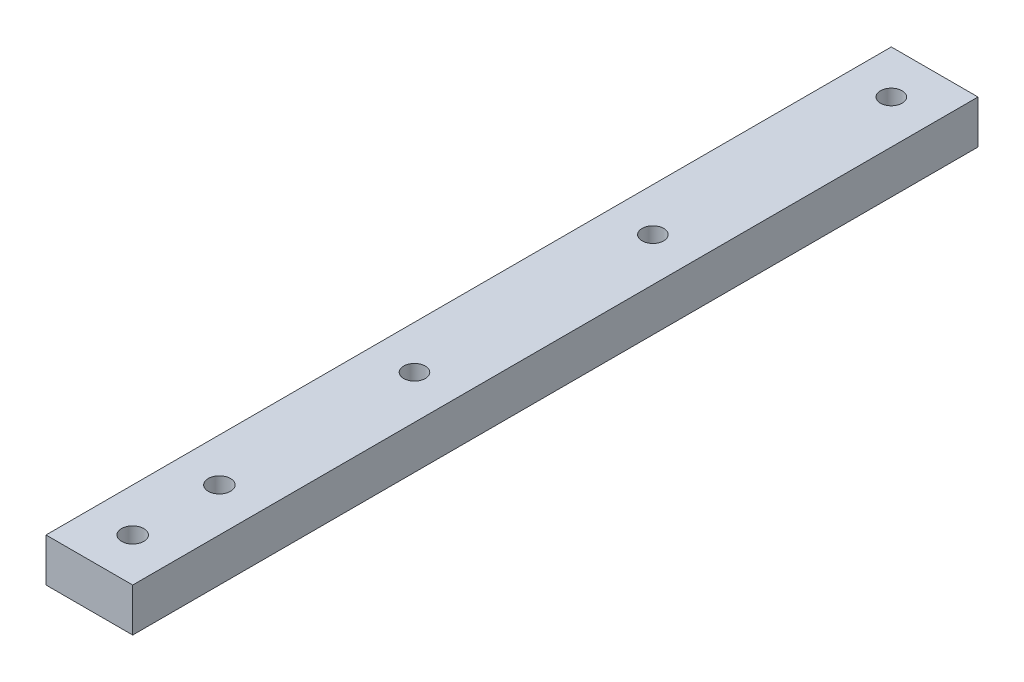
from build123d import *

# Parameters (mm, degrees)
SKETCH1_W                   = 25.4
SKETCH1_H                   = 12.7
BOSS_EXTRUDE1_DEPTH         = 247.65
F_1_4_CLEARANCE_HOLE1_D     = 6.5278
F_1_4_0_25_DIAMETER_HOLE1_D = 6.35


with BuildPart() as part:
    # Sketch1 → Boss-Extrude1 (new body)
    with BuildSketch(Plane.XY):
        Rectangle(SKETCH1_W, SKETCH1_H)
    extrude(amount=BOSS_EXTRUDE1_DEPTH)

    # 1/4 Clearance Hole1 (through all)
    with Locations(Plane(origin=(0, 6.35, 0), x_dir=(1, 0, 0), z_dir=(0, 1, 0))):
        with Locations((0, -234.95), (0, -209.55)):
            Hole(F_1_4_CLEARANCE_HOLE1_D / 2)

    # 1/4 (0.25) Diameter Hole1 (through all)
    with Locations(Plane(origin=(0, 6.35, 0), x_dir=(1, 0, 0), z_dir=(0, 1, 0))):
        with Locations((0, -82.55), (0, -12.7), (0, -152.4)):
            Hole(F_1_4_0_25_DIAMETER_HOLE1_D / 2)


solid = part.part
